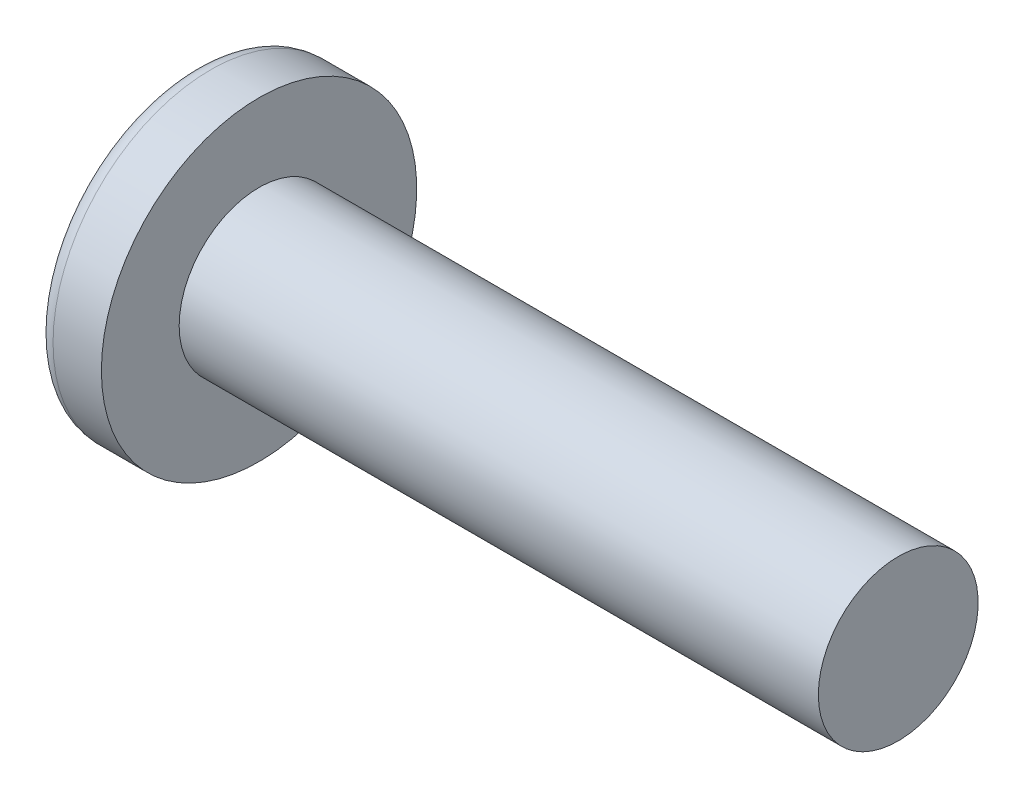
from build123d import *

# Parameters (mm, degrees)
CIRPATTERN1_COUNT = 2
CIRPATTERN1_ANGLE = 90


with BuildPart() as part:
    # BodySke → Base-Revolve (revolve)
    with BuildSketch(Plane.XY, mode=Mode.PRIVATE) as base_revolve_sk:
        with BuildLine():
            Line((6.6294, 4.7625), (6.6294, 9.398))
            Line((6.6294, 9.398), (3.748078838, 9.398))
            ThreePointArc((3.748078838, 9.398), (3.287664738, 9.287690266), (2.927227326, 8.980714286))
            ThreePointArc((2.927227326, 8.980714286), (0.750275097, 4.72286695), (0, 0))
            Line((0, 0), (44.7294, 0))
            Line((44.7294, 0), (44.7294, 4.7625))
            Line((44.7294, 4.7625), (6.6294, 4.7625))
        make_face()
    revolve(base_revolve_sk.sketch.rotate(Axis((-25.4, 0, 0), (1, 0, 0)), 90), axis=Axis((-25.4, 0, 0), (1, 0, 0)))

    # Sketch3 → Cut-Loft1 section 0
    with BuildSketch(Plane(origin=(0, 0, 0), x_dir=(0, 0, -1), z_dir=(1, 0, 0))):
        with BuildLine():
            Line((1.0287, -6.096), (-1.0287, -6.096))
            Line((-1.0287, -6.096), (-1.0287, 6.096))
            Line((-1.0287, 6.096), (1.0287, 6.096))
            Line((1.0287, 6.096), (1.0287, -6.096))
        make_face()
    # Sketch4 → Cut-Loft1 section 1
    with BuildSketch(Plane(origin=(7.2644, 0, 0), x_dir=(0, 0, -1), z_dir=(1, 0, 0))):
        with BuildLine():
            Line((0.51435, -0.51435), (-0.51435, -0.51435))
            Line((-0.51435, -0.51435), (-0.51435, 0.51435))
            Line((-0.51435, 0.51435), (0.51435, 0.51435))
            Line((0.51435, 0.51435), (0.51435, -0.51435))
        make_face()
    cut_loft1 = loft(mode=Mode.SUBTRACT)

    # CirPattern1: Cut-Loft1 ×2 about axis
    cirpattern1_axis = Axis((0, 0, 0), (1, 0, 0))
    for i in range(1, CIRPATTERN1_COUNT):
        add(cut_loft1.rotate(cirpattern1_axis, i * CIRPATTERN1_ANGLE / (CIRPATTERN1_COUNT - 1)), mode=Mode.SUBTRACT)


solid = part.part
